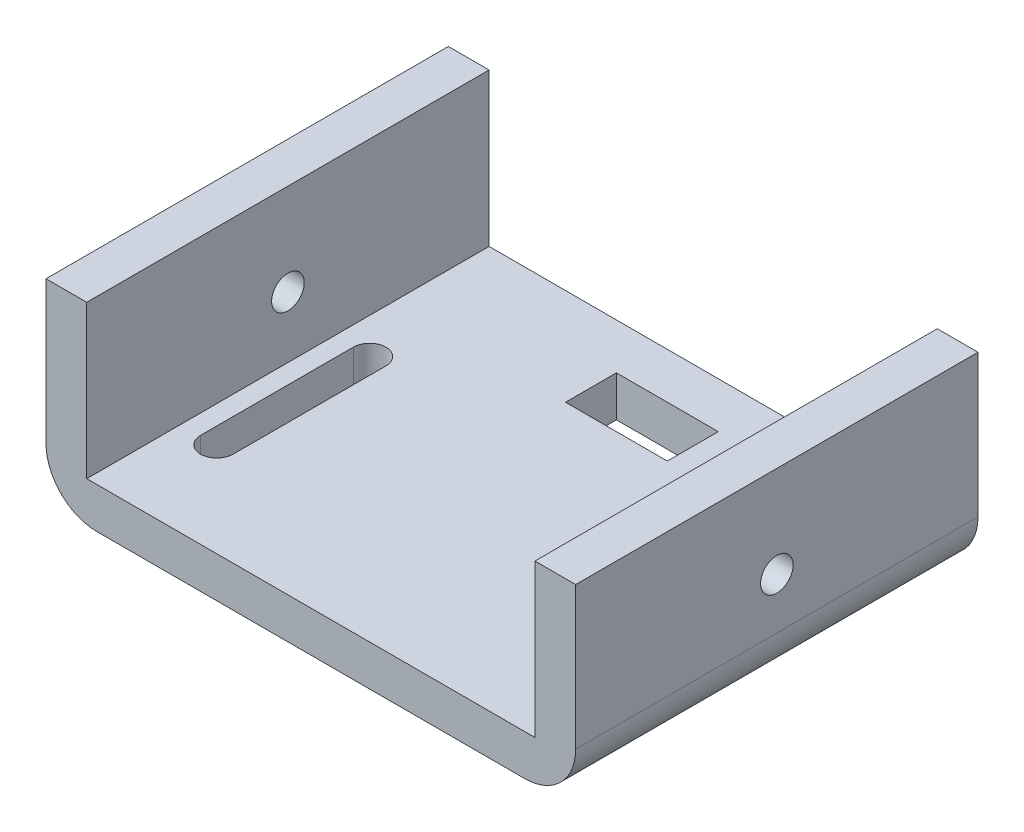
from build123d import *

# Parameters (mm, degrees)
BOSS_EXTRU_1_DEPTH      = 39.5
ESQUISSE3_W             = 10
ESQUISSE3_H             = 5
ENL_V_MAT_EXTRU_1_DEPTH = 51.963222033
CUT_EXTRUDE1_DEPTH      = 64.947243881
CUT_EXTRUDE1_DEPTH_BACK = 64.947243881
SKETCH1_R               = 1.6
CUT_EXTRUDE2_DEPTH      = 51.963222033
FILLET1_R               = 5


with BuildPart() as part:
    # Esquisse1 → Boss.-Extru.1 (new body)
    with BuildSketch(Plane.XY):
        Polygon((-22, 0), (22, 0), (22, 15), (26, 15), (26, -4), (-26, -4), (-26, 15), (-22, 15), align=None)
    extrude(amount=BOSS_EXTRU_1_DEPTH)

    # Esquisse3 → Enlèv. mat.-Extru.1 (cut, through all)
    with BuildSketch(Plane.XZ.offset(4)):
        with Locations((0, 7)):
            Rectangle(ESQUISSE3_W, ESQUISSE3_H)
    extrude(amount=-ENL_V_MAT_EXTRU_1_DEPTH, mode=Mode.SUBTRACT)

    # Sketch1 → Cut-Extrude1 (cut, two sides: drawn at the far end of the back side and taken through both)
    with BuildSketch(Plane(origin=(-22, 0, 0), x_dir=(0, 0, -1), z_dir=(1, 0, 0)).offset(-CUT_EXTRUDE1_DEPTH_BACK)):
        with Locations((-19.75, 6)):
            Circle(SKETCH1_R)
    extrude(amount=CUT_EXTRUDE1_DEPTH + CUT_EXTRUDE1_DEPTH_BACK, mode=Mode.SUBTRACT)

    # Sketch2 → Cut-Extrude2 (cut, through all)
    with BuildSketch(Plane.XZ.offset(4)):
        with BuildLine():
            Line((-16.9, 30.226876468), (-16.9, 15.226876468))
            ThreePointArc((-16.9, 15.226876468), (-18.5, 13.626876468), (-20.1, 15.226876468))
            Line((-20.1, 15.226876468), (-20.1, 30.226876468))
            ThreePointArc((-20.1, 30.226876468), (-18.5, 31.826876468), (-16.9, 30.226876468))
        make_face()
        with BuildLine():
            Line((20.1, 30.226876468), (20.1, 15.226876468))
            ThreePointArc((20.1, 15.226876468), (18.5, 13.626876468), (16.9, 15.226876468))
            Line((16.9, 15.226876468), (16.9, 30.226876468))
            ThreePointArc((16.9, 30.226876468), (18.5, 31.826876468), (20.1, 30.226876468))
        make_face()
    extrude(amount=-CUT_EXTRUDE2_DEPTH, mode=Mode.SUBTRACT)

    # Fillet1
    fillet1_edges = [part.edges().sort_by_distance(p)[0] for p in [
        (26, -4, 19.75),
        (-26, -4, 19.75),
    ]]
    fillet(fillet1_edges, radius=FILLET1_R)


solid = part.part
